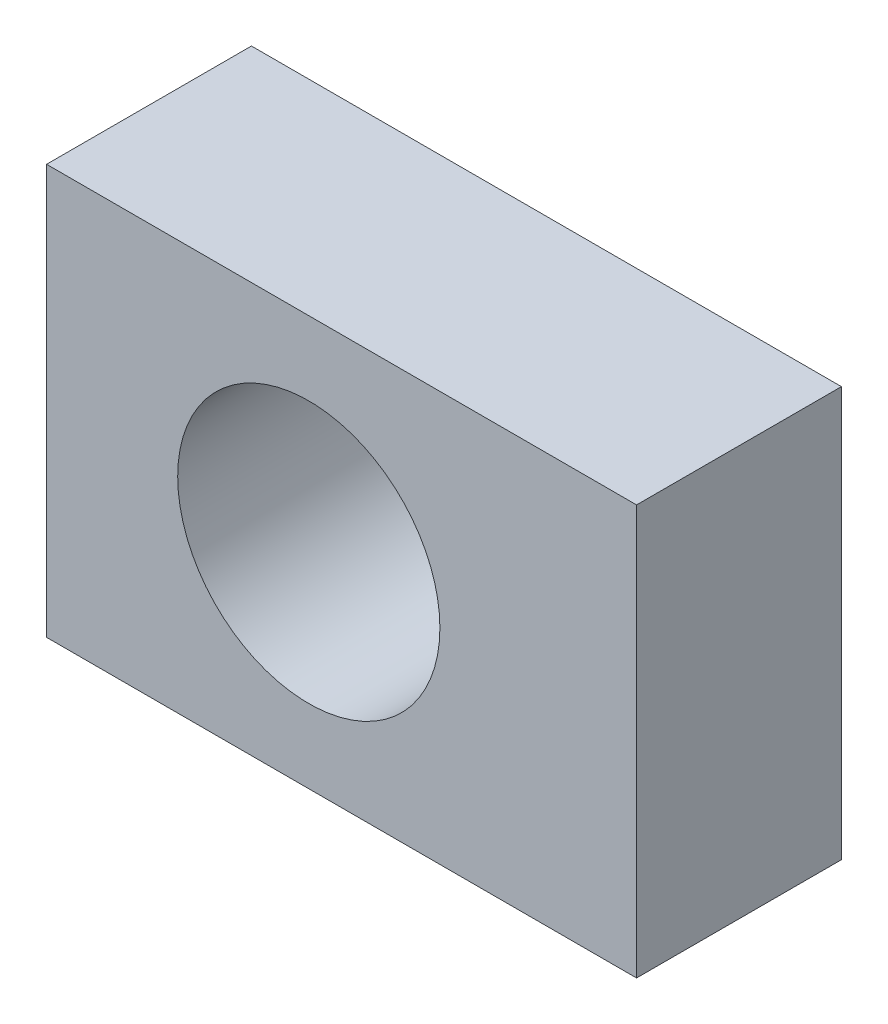
from build123d import *

# Parameters (mm, degrees)
SKETCH4_W           = 9.144
SKETCH4_H           = 6.35
SKETCH4_R           = 2.032
BOSS_EXTRUDE2_DEPTH = 3.175


with BuildPart() as part:
    # Sketch4 → Boss-Extrude2 (new body)
    with BuildSketch(Plane.XY):
        with Locations((4.572, -3.175)):
            Rectangle(SKETCH4_W, SKETCH4_H)
        with Locations((4.064, -3.175)):
            Circle(SKETCH4_R, mode=Mode.SUBTRACT)
    extrude(amount=BOSS_EXTRUDE2_DEPTH)


solid = part.part
